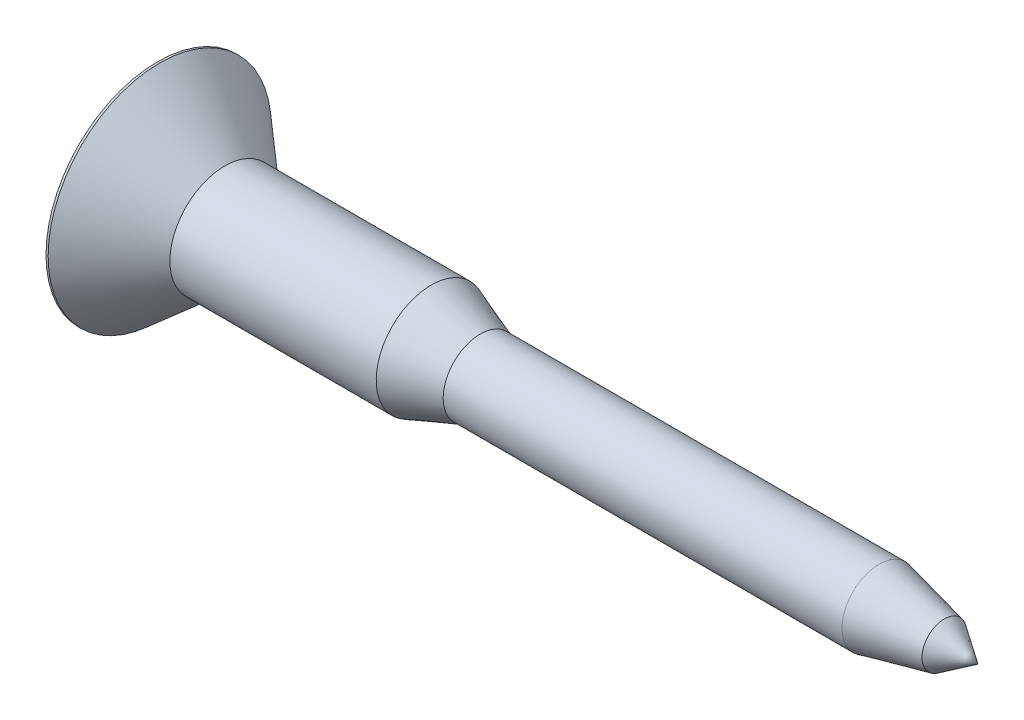
from build123d import *

# Parameters (mm, degrees)
BOSS_EXTRUDE1_START = -25.4
BOSS_EXTRUDE1_DEPTH = 3.1242
CUT_EXTRUDE2_DEPTH  = 28.214390217
DRAFT2_ANGLE        = -3
CIRPATTERN3_COUNT   = 4


with BuildPart() as part:
    # Sketch13 → Revolve2 (revolve)
    with BuildSketch(Plane.XY, mode=Mode.PRIVATE) as revolve2_sk:
        Polygon((-25.4, 0), (-25.4, 6.9088), (-25.266671341, 6.9088), (-21.2344, 3.4036), (-8.4582, 3.4036), (-5.419022903, 2.29743), (19.27352, 2.29743), (23.312066741, 1.382457188), (25.4, 0), align=None)
    revolve(revolve2_sk.sketch.rotate(Axis((-25.4, 0, 0), (1, 0, 0)), 180), axis=Axis((-25.4, 0, 0), (1, 0, 0)))


with BuildPart() as body_2:
    # Sketch9 → Boss-Extrude1 (new body)
    with BuildSketch(Plane(origin=(0, 0, 0), x_dir=(0, 0, -1), z_dir=(1, 0, 0)).offset(BOSS_EXTRUDE1_START)):
        Polygon((0.621792, -1.648367869), (0.621792, -3.523488), (-0.621792, -3.523488), (-0.621792, -1.648367869), (-0.933766565, -0.933766565), (-1.648367869, -0.621792), (-3.523488, -0.621792), (-3.523488, 0.621792), (-1.648367869, 0.621792), (-0.933766565, 0.933766565), (-0.621792, 1.648367869), (-0.621792, 3.523488), (0.621792, 3.523488), (0.621792, 1.648367869), (0.933766565, 0.933766565), (1.648367869, 0.621792), (3.523488, 0.621792), (3.523488, -0.621792), (1.648367869, -0.621792), (0.933766565, -0.933766565), align=None)
    extrude(amount=BOSS_EXTRUDE1_DEPTH)

    # Sketch10 → Cut-Extrude2 (cut, symmetric)
    with BuildSketch(Plane.XY):
        Polygon((-24.96566, 3.523488), (-22.2758, 1.907257055), (-22.2758, 3.523488), align=None)
    cut_extrude2 = extrude(amount=CUT_EXTRUDE2_DEPTH, both=True, mode=Mode.SUBTRACT)

    # Draft2
    draft2_faces = [body_2.faces().sort_by_distance(p)[0] for p in [
        (-23.8379, 0.777779282, 1.291067217),
        (-23.8379, 1.291067217, 0.777779282),
        (-23.8379, 1.291067217, -0.777779282),
        (-23.8379, 0.777779282, -1.291067217),
        (-23.8379, -0.777779282, -1.291067217),
        (-23.8379, -1.291067217, -0.777779282),
        (-23.8379, -0.777779282, 1.291067217),
        (-23.8379, -1.291067217, 0.777779282),
    ]]
    draft(draft2_faces, Plane(origin=(-25.4, 0, 0), x_dir=(0, 0, -1), z_dir=(-1, 0, 0)), DRAFT2_ANGLE)

    # CirPattern3: Cut-Extrude2 ×4 about axis
    cirpattern3_axis = Axis((0, 0, 0), (1, 0, 0))
    for i in range(1, CIRPATTERN3_COUNT):
        add(cut_extrude2.rotate(cirpattern3_axis, i * 360 / CIRPATTERN3_COUNT), mode=Mode.SUBTRACT)


with BuildPart() as part_1:
    add(part.part)

    # Combine2: cut body 2
    add(body_2.part, mode=Mode.SUBTRACT)


solid = part_1.part
